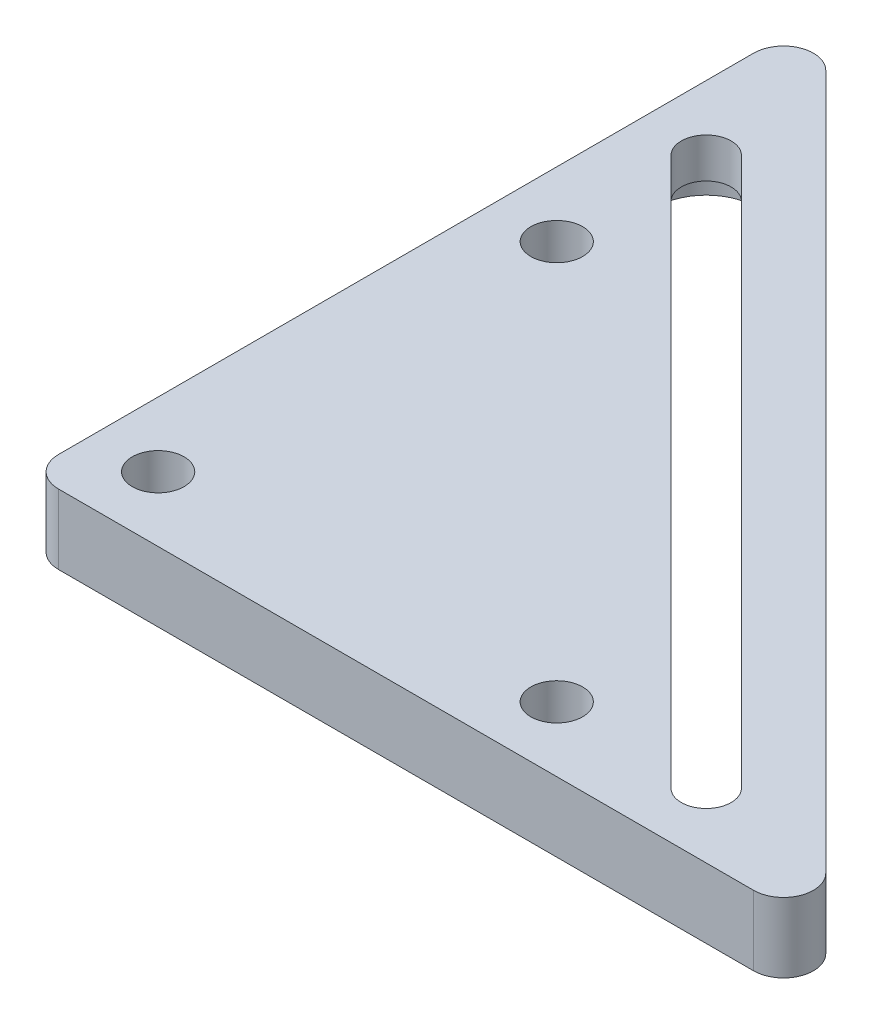
from build123d import *

# Parameters (mm, degrees)
EXTRUDE_1_DEPTH      = 10
SKETCH_5_R           = 2.6
CUT_EXTRUDE_3_DEPTH  = 10
FILLET_5_R           = 3
FILLET_6_R           = 3
FILLET_7_R           = 3
SKETCH_7_R           = 5.5
CUT_EXTRUDE_4_DEPTH  = 5
SKETCH_12_R          = 2.553682631
CUT_EXTRUDE_9_DEPTH  = 9
EXTRUDE_2_DEPTH      = 5
CUT_EXTRUDE_START    = 5
SKETCH_14_R          = 5.5
CUT_EXTRUDE_12_DEPTH = 5
EXTRUDE_START        = 5
EXTRUDE_6_DEPTH      = 5
SKETCH_22_R          = 5.5
EXTRUDE_7_DEPTH      = 5
SKETCH_24_R          = 5.5
CUT_EXTRUDE_14_DEPTH = 3
SKETCH_25_R          = 2.65
CUT_EXTRUDE_15_DEPTH = 3
SKETCH_26_R          = 2.65
CUT_EXTRUDE_16_DEPTH = 5
SKETCH_29_R          = 2.65
EXTRUDE_8_DEPTH      = 10
EXTRUDE_START_2      = 3
SKETCH_30_R          = 5.5
EXTRUDE_9_DEPTH      = 3
CUT_EXTRUDE_18_DEPTH = 3
SKETCH_33_R          = 5.5
SKETCH_33_R_2        = 2.6
EXTRUDE_10_DEPTH     = 5
SKETCH_34_W          = 118.655960463
SKETCH_34_H          = 108.474675719
CUT_EXTRUDE_20_DEPTH = 3
CUT_EXTRUDE_21_DEPTH = 108.211729676
SKETCH_36_R          = 2.6
CUT_EXTRUDE_23_DEPTH = 108.365520444


with BuildPart() as part:
    # 草图1 → 凸台-拉伸1 (new body)
    with BuildSketch(Plane(origin=(0, 0, 0), x_dir=(1, 0, 0), z_dir=(0, 1, 0))):
        Polygon((0, 0), (0, 80), (80, 0), align=None)
    extrude(amount=EXTRUDE_1_DEPTH)

    # 草图5 → 切除-拉伸3 (cut)
    with BuildSketch(Plane(origin=(0, 10, 0), x_dir=(1, 0, 0), z_dir=(0, 1, 0))):
        with Locations(Location((6.5, 6.5, 0), (0, 0, 270))):
            Circle(SKETCH_5_R)
        with Locations(Location((6.5, 46.5, 0), (0, 0, 270))):
            Circle(SKETCH_5_R)
        with Locations(Location((46.5, 6.5, 0), (0, 0, 270))):
            Circle(SKETCH_5_R)
    extrude(amount=-CUT_EXTRUDE_3_DEPTH, mode=Mode.SUBTRACT)

    # 圆角5
    fillet_5_edges = [part.edges().sort_by_distance(p)[0] for p in [
        (80, 5, 0),
    ]]
    fillet(fillet_5_edges, radius=FILLET_5_R)

    # 圆角6
    fillet_6_edges = [part.edges().sort_by_distance(p)[0] for p in [
        (0, 5, -80),
    ]]
    fillet(fillet_6_edges, radius=FILLET_6_R)

    # 圆角7
    fillet_7_edges = [part.edges().sort_by_distance(p)[0] for p in [
        (0, 5, 0),
    ]]
    fillet(fillet_7_edges, radius=FILLET_7_R)

    # 草图7 → 切除-拉伸4 (cut)
    with BuildSketch(Plane(origin=(0, 10, 0), x_dir=(1, 0, 0), z_dir=(0, 1, 0))):
        with Locations(Location((6.5, 6.5, 0), (0, 0, 270))):
            Circle(SKETCH_7_R)
        with Locations(Location((6.5, 46.5, 0), (0, 0, 270))):
            Circle(SKETCH_7_R)
        with Locations(Location((46.5, 6.5, 0), (0, 0, 270))):
            Circle(SKETCH_7_R)
    extrude(amount=-CUT_EXTRUDE_4_DEPTH, mode=Mode.SUBTRACT)

    # 草图12 → 切除-拉伸9 (cut)
    with BuildSketch(Plane.XZ):
        with Locations((8.5, -46.5)):
            Circle(SKETCH_12_R)
    extrude(amount=-CUT_EXTRUDE_9_DEPTH, mode=Mode.SUBTRACT)

    # 草图13 → 凸台-拉伸2 (add)
    with BuildSketch(Plane.XZ):
        with BuildLine():
            ThreePointArc((7.559676255, -48.87425488), (5.946317369, -46.5), (7.559676255, -44.12574512))
            ThreePointArc((7.559676255, -44.12574512), (3.9, -46.5), (7.559676255, -48.87425488))
        make_face()
    extrude(amount=-EXTRUDE_2_DEPTH)

    # 草图14 → 切除-拉伸12 (cut)
    with BuildSketch(Plane(origin=(0, 5, 0), x_dir=(1, 0, 0), z_dir=(0, 1, 0)).offset(CUT_EXTRUDE_START)):
        with Locations((8.5, 46.5)):
            Circle(SKETCH_14_R)
        with Locations((6.5, 46.5)):
            Circle(SKETCH_14_R)
    extrude(amount=-CUT_EXTRUDE_12_DEPTH, mode=Mode.SUBTRACT)

    # 草图21 → 凸台-拉伸6 (add)
    with BuildSketch(Plane(origin=(0, 5, 0), x_dir=(1, 0, 0), z_dir=(0, 1, 0)).offset(EXTRUDE_START)):
        with BuildLine():
            ThreePointArc((7.5, 41.091673087), (3, 46.5), (7.5, 51.908326913))
            ThreePointArc((7.5, 51.908326913), (1, 46.5), (7.5, 41.091673087))
        make_face()
    extrude(amount=-EXTRUDE_6_DEPTH)

    # 草图22 → 凸台-拉伸7 (add)
    with BuildSketch(Plane(origin=(0, 5, 0), x_dir=(1, 0, 0), z_dir=(0, 1, 0)).offset(EXTRUDE_START)):
        with Locations((8.5, 46.5)):
            Circle(SKETCH_22_R)
    extrude(amount=-EXTRUDE_7_DEPTH)

    # 草图24 → 切除-拉伸14 (cut)
    with BuildSketch(Plane(origin=(0, 10, 0), x_dir=(1, 0, 0), z_dir=(0, 1, 0))):
        with Locations(Location((8.5, 46.5, 0), (0, 0, 270))):
            Circle(SKETCH_24_R)
    extrude(amount=-CUT_EXTRUDE_14_DEPTH, mode=Mode.SUBTRACT)

    # 草图25 → 切除-拉伸15 (cut)
    with BuildSketch(Plane.XZ.offset(-5)):
        with Locations(Location((8.5, -46.5, 0), (0, 0, 270))):
            Circle(SKETCH_25_R)
    extrude(amount=-CUT_EXTRUDE_15_DEPTH, mode=Mode.SUBTRACT)

    # 草图26 → 切除-拉伸16 (cut)
    with BuildSketch(Plane.XZ):
        with Locations(Location((8.5, -46.5, 0), (0, 0, 270))):
            Circle(SKETCH_26_R)
    extrude(amount=-CUT_EXTRUDE_16_DEPTH, mode=Mode.SUBTRACT)

    # 草图29 → 凸台-拉伸8 (add)
    with BuildSketch(Plane.XZ):
        with Locations(Location((8.5, -46.5, 0), (0, 0, 270))):
            Circle(SKETCH_29_R)
    extrude(amount=-EXTRUDE_8_DEPTH)

    # 草图30 → 凸台-拉伸9 (add)
    with BuildSketch(Plane(origin=(0, 7, 0), x_dir=(1, 0, 0), z_dir=(0, 1, 0)).offset(EXTRUDE_START_2)):
        with Locations((8.5, 46.5)):
            Circle(SKETCH_30_R)
    extrude(amount=-EXTRUDE_9_DEPTH)

    # 草图2 → 切除-拉伸18 (cut)
    with BuildSketch(Plane.XZ):
        with BuildLine():
            ThreePointArc((6.5, -56.5), (8.413417162, -56.880602337), (10.035533906, -57.964466094))
            Line((10.035533906, -57.964466094), (57.964466094, -10.035533906))
            ThreePointArc((57.964466094, -10.035533906), (56.880602337, -8.413417162), (56.5, -6.5))
            Line((56.5, -6.5), (54.428932188, -6.5))
            Line((54.428932188, -6.5), (6.5, -54.428932188))
            Line((6.5, -54.428932188), (6.5, -56.5))
        make_face()
        with BuildLine():
            Line((57.964466094, -10.035533906), (10.035533906, -57.964466094))
            ThreePointArc((10.035533906, -57.964466094), (11.119397663, -59.586582838), (11.5, -61.5))
            ThreePointArc((11.5, -61.5), (11.119397663, -63.413417162), (10.035533906, -65.035533906))
            Line((10.035533906, -65.035533906), (65.035533906, -10.035533906))
            ThreePointArc((65.035533906, -10.035533906), (61.5, -11.5), (57.964466094, -10.035533906))
        make_face()
        with BuildLine():
            Line((6.5, -66.5), (6.5, -61.5))
            Line((6.5, -61.5), (6.5, -56.5))
            ThreePointArc((6.5, -56.5), (4.586582838, -56.880602337), (2.964466094, -57.964466094))
            ThreePointArc((2.964466094, -57.964466094), (1.880602337, -63.413417162), (6.5, -66.5))
        make_face()
        with BuildLine():
            Line((6.5, -56.5), (6.5, -61.5))
            Line((6.5, -61.5), (10.035533906, -57.964466094))
            ThreePointArc((10.035533906, -57.964466094), (8.413417162, -56.880602337), (6.5, -56.5))
        make_face()
        with BuildLine():
            Line((10.035533906, -57.964466094), (6.5, -61.5))
            Line((6.5, -61.5), (6.5, -66.5))
            ThreePointArc((6.5, -66.5), (8.413417162, -66.119397663), (10.035533906, -65.035533906))
            ThreePointArc((10.035533906, -65.035533906), (11.119397663, -63.413417162), (11.5, -61.5))
            ThreePointArc((11.5, -61.5), (11.119397663, -59.586582838), (10.035533906, -57.964466094))
        make_face()
        with BuildLine():
            Line((6.5, -56.5), (6.5, -61.5))
            Line((6.5, -61.5), (10.035533906, -57.964466094))
            ThreePointArc((10.035533906, -57.964466094), (8.413417162, -56.880602337), (6.5, -56.5))
        make_face()
        with BuildLine():
            Line((10.035533906, -57.964466094), (6.5, -61.5))
            Line((6.5, -61.5), (6.5, -66.5))
            ThreePointArc((6.5, -66.5), (8.413417162, -66.119397663), (10.035533906, -65.035533906))
            ThreePointArc((10.035533906, -65.035533906), (11.119397663, -63.413417162), (11.5, -61.5))
            ThreePointArc((11.5, -61.5), (11.119397663, -59.586582838), (10.035533906, -57.964466094))
        make_face()
        with BuildLine():
            ThreePointArc((2.964466094, -57.964466094), (4.586582838, -56.880602337), (6.5, -56.5))
            Line((6.5, -56.5), (6.5, -54.428932188))
            Line((6.5, -54.428932188), (2.964466094, -57.964466094))
        make_face()
        with BuildLine():
            Line((54.428932188, -6.5), (56.5, -6.5))
            ThreePointArc((56.5, -6.5), (56.880602337, -4.586582838), (57.964466094, -2.964466094))
            Line((57.964466094, -2.964466094), (54.428932188, -6.5))
        make_face()
        with BuildLine():
            Line((56.5, -6.5), (61.5, -6.5))
            Line((61.5, -6.5), (66.5, -6.5))
            ThreePointArc((66.5, -6.5), (63.413417162, -1.880602337), (57.964466094, -2.964466094))
            ThreePointArc((57.964466094, -2.964466094), (56.880602337, -4.586582838), (56.5, -6.5))
        make_face()
        with BuildLine():
            ThreePointArc((56.5, -6.5), (56.880602337, -8.413417162), (57.964466094, -10.035533906))
            Line((57.964466094, -10.035533906), (61.5, -6.5))
            Line((61.5, -6.5), (56.5, -6.5))
        make_face()
        with BuildLine():
            Line((61.5, -6.5), (57.964466094, -10.035533906))
            ThreePointArc((57.964466094, -10.035533906), (61.5, -11.5), (65.035533906, -10.035533906))
            ThreePointArc((65.035533906, -10.035533906), (66.119397663, -8.413417162), (66.5, -6.5))
            Line((66.5, -6.5), (61.5, -6.5))
        make_face()
        with BuildLine():
            ThreePointArc((56.5, -6.5), (56.880602337, -8.413417162), (57.964466094, -10.035533906))
            Line((57.964466094, -10.035533906), (61.5, -6.5))
            Line((61.5, -6.5), (56.5, -6.5))
        make_face()
        with BuildLine():
            Line((61.5, -6.5), (57.964466094, -10.035533906))
            ThreePointArc((57.964466094, -10.035533906), (61.5, -11.5), (65.035533906, -10.035533906))
            ThreePointArc((65.035533906, -10.035533906), (66.119397663, -8.413417162), (66.5, -6.5))
            Line((66.5, -6.5), (61.5, -6.5))
        make_face()
    extrude(amount=-CUT_EXTRUDE_18_DEPTH, mode=Mode.SUBTRACT)

    # 草图33 → 凸台-拉伸10 (add)
    # profile 1 of 2: a face of its own
    with BuildSketch(Plane(origin=(0, 10, 0), x_dir=(1, 0, 0), z_dir=(0, 1, 0))):
        with Locations((6.5, 6.5)):
            Circle(SKETCH_33_R)
        with Locations(Location((6.5, 6.5, 0), (0, 0, 270))):
            Circle(SKETCH_33_R_2, mode=Mode.SUBTRACT)
    # profile 2 of 2: a face of its own
    with BuildSketch(Plane(origin=(0, 10, 0), x_dir=(1, 0, 0), z_dir=(0, 1, 0))):
        with Locations((46.5, 6.5)):
            Circle(SKETCH_33_R)
        with Locations(Location((46.5, 6.5, 0), (0, 0, 270))):
            Circle(SKETCH_33_R_2, mode=Mode.SUBTRACT)
    extrude(amount=-EXTRUDE_10_DEPTH)

    # 草图34 → 切除-拉伸20 (cut)
    with BuildSketch(Plane(origin=(0, 10, 0), x_dir=(1, 0, 0), z_dir=(0, 1, 0))):
        with Locations((37.4387476, 33.290816779)):
            Rectangle(SKETCH_34_W, SKETCH_34_H)
    extrude(amount=-CUT_EXTRUDE_20_DEPTH, mode=Mode.SUBTRACT)

    # 草图35 → 切除-拉伸21 (cut, through all)
    with BuildSketch(Plane.XZ.offset(-3)):
        with BuildLine():
            Line((8.267766953, -63.267766953), (63.267766953, -8.267766953))
            ThreePointArc((63.267766953, -8.267766953), (63.267766953, -4.732233047), (59.732233047, -4.732233047))
            Line((59.732233047, -4.732233047), (4.732233047, -59.732233047))
            ThreePointArc((4.732233047, -59.732233047), (4.732233047, -63.267766953), (8.267766953, -63.267766953))
        make_face()
    extrude(amount=-CUT_EXTRUDE_21_DEPTH, mode=Mode.SUBTRACT)

    # 草图36 → 切除-拉伸23 (cut, through all)
    with BuildSketch(Plane(origin=(0, 7, 0), x_dir=(1, 0, 0), z_dir=(0, 1, 0))):
        with Locations(Location((6.5, 46.5, 0), (0, 0, 270))):
            Circle(SKETCH_36_R)
    extrude(amount=-CUT_EXTRUDE_23_DEPTH, mode=Mode.SUBTRACT)


solid = part.part
